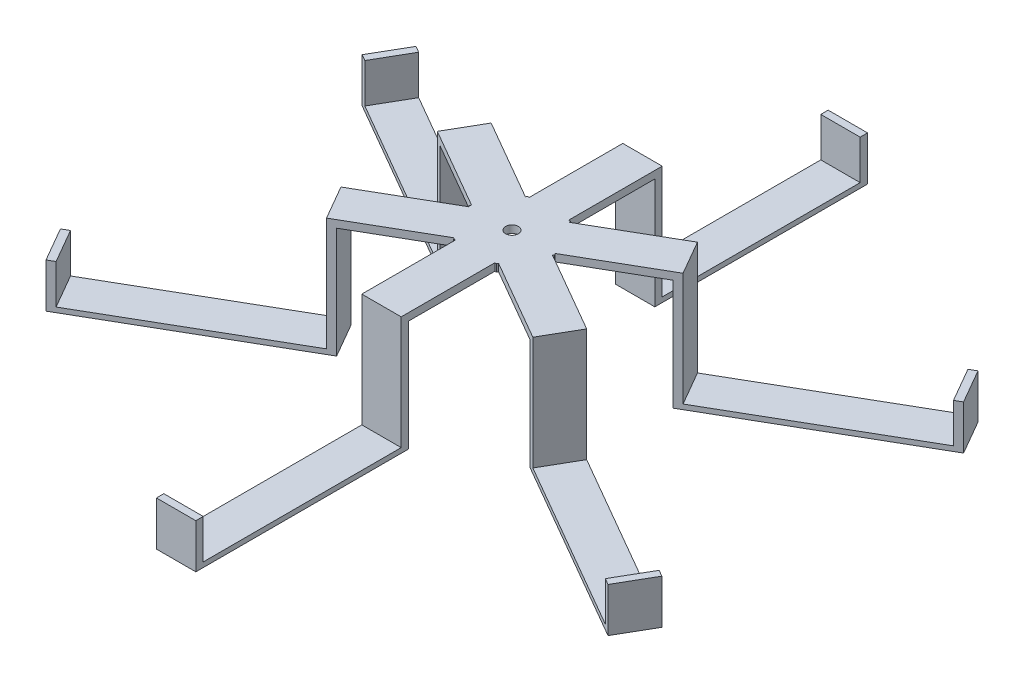
from build123d import *

# Parameters (mm, degrees)
SKETCH_1_R               = 2.6
EXTRUDE_1_DEPTH          = 3
EXTRUDE_2_DEPTH          = 8
PATTERN_CIRCULAR_1_COUNT = 6


with BuildPart() as part:
    # 草图1 → 凸台-拉伸1 (new body)
    with BuildSketch(Plane(origin=(0, 0, 0), x_dir=(1, 0, 0), z_dir=(0, 1, 0))):
        Polygon((8.660254038, 15), (-8.660254038, 15), (-17.320508076, 0), (-8.660254038, -15), (8.660254038, -15), (17.320508076, 0), align=None)
        Circle(SKETCH_1_R, mode=Mode.SUBTRACT)
    extrude(amount=EXTRUDE_1_DEPTH)

    # 草图2 → 凸台-拉伸2 (add, symmetric)
    with BuildSketch(Plane(origin=(0, 0, 0), x_dir=(0, 0, -1), z_dir=(1, 0, 0))):
        Polygon((15, 0), (50, 0), (50, -45), (136.4, -45), (136.4, -27), (133.4, -27), (133.4, -43), (53, -43), (53, 3), (15, 3), align=None)
    extrude_2 = extrude(amount=EXTRUDE_2_DEPTH, both=True)

    # 阵列(圆周)1: 凸台-拉伸2 ×6 about axis
    pattern_circular_1_axis = Axis((0, 3, 0), (0, 1, 0))
    for i in range(1, PATTERN_CIRCULAR_1_COUNT):
        add(extrude_2.rotate(pattern_circular_1_axis, i * 360 / PATTERN_CIRCULAR_1_COUNT))


solid = part.part
